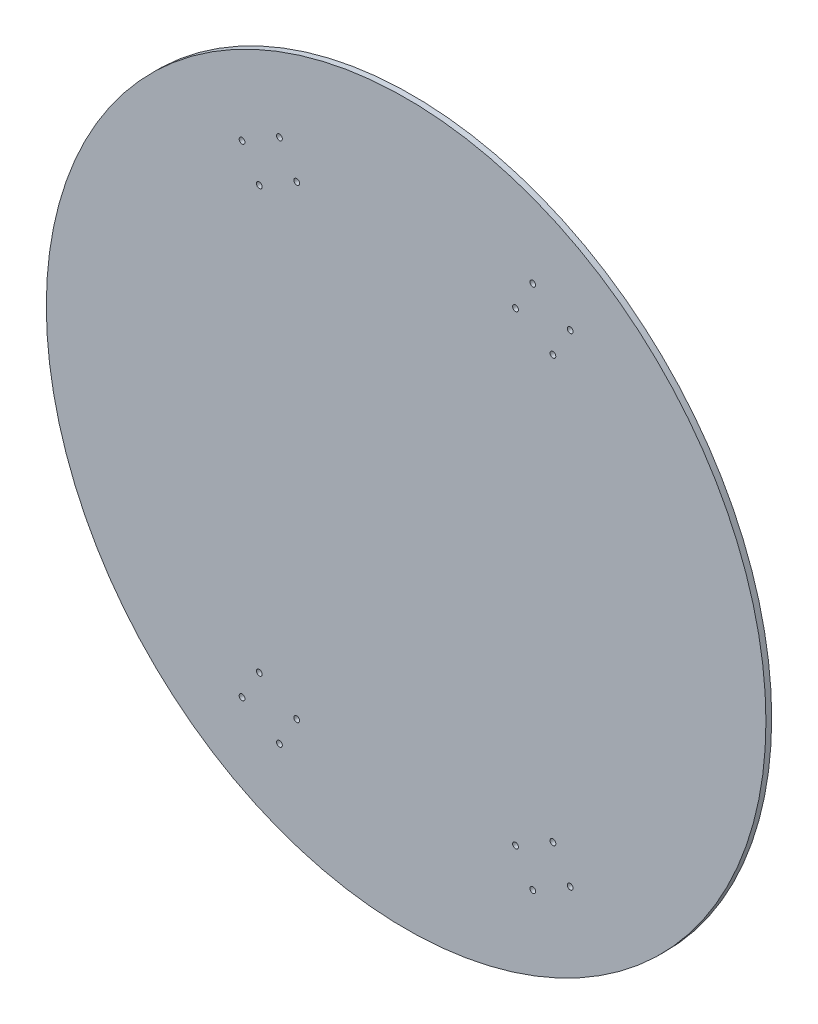
from build123d import *

# Parameters (mm, degrees)
SKETCH1_R           = 250
BOSS_EXTRUDE1_DEPTH = 4
SKETCH5_R           = 2
CUT_EXTRUDE3_DEPTH  = 10


with BuildPart() as part:
    # Sketch1 → Boss-Extrude1 (new body)
    with BuildSketch(Plane.XY):
        Circle(SKETCH1_R)
    extrude(amount=BOSS_EXTRUDE1_DEPTH)

    # Sketch5 → Cut-Extrude3 (cut)
    with BuildSketch(Plane.XY.offset(4)):
        with Locations((-101.990381057, 146.652521874)):
            Circle(SKETCH5_R)
        with Locations((-76.009618943, 161.652521874)):
            Circle(SKETCH5_R)
        with Locations((-113.990381057, 167.437131564)):
            Circle(SKETCH5_R)
        with Locations((-88.009618943, 182.437131564)):
            Circle(SKETCH5_R)
        with Locations((76.009618943, 161.652521874)):
            Circle(SKETCH5_R)
        with Locations((101.990381057, 146.652521874)):
            Circle(SKETCH5_R)
        with Locations((88.009618943, 182.437131564)):
            Circle(SKETCH5_R)
        with Locations((113.990381057, 167.437131564)):
            Circle(SKETCH5_R)
        with Locations((101.990381057, -146.652521874)):
            Circle(SKETCH5_R)
        with Locations((76.009618943, -161.652521874)):
            Circle(SKETCH5_R)
        with Locations((113.990381057, -167.437131564)):
            Circle(SKETCH5_R)
        with Locations((88.009618943, -182.437131564)):
            Circle(SKETCH5_R)
        with Locations((-76.009618943, -161.652521874)):
            Circle(SKETCH5_R)
        with Locations((-101.990381057, -146.652521874)):
            Circle(SKETCH5_R)
        with Locations((-88.009618943, -182.437131564)):
            Circle(SKETCH5_R)
        with Locations((-113.990381057, -167.437131564)):
            Circle(SKETCH5_R)
    extrude(amount=-CUT_EXTRUDE3_DEPTH, mode=Mode.SUBTRACT)


solid = part.part
